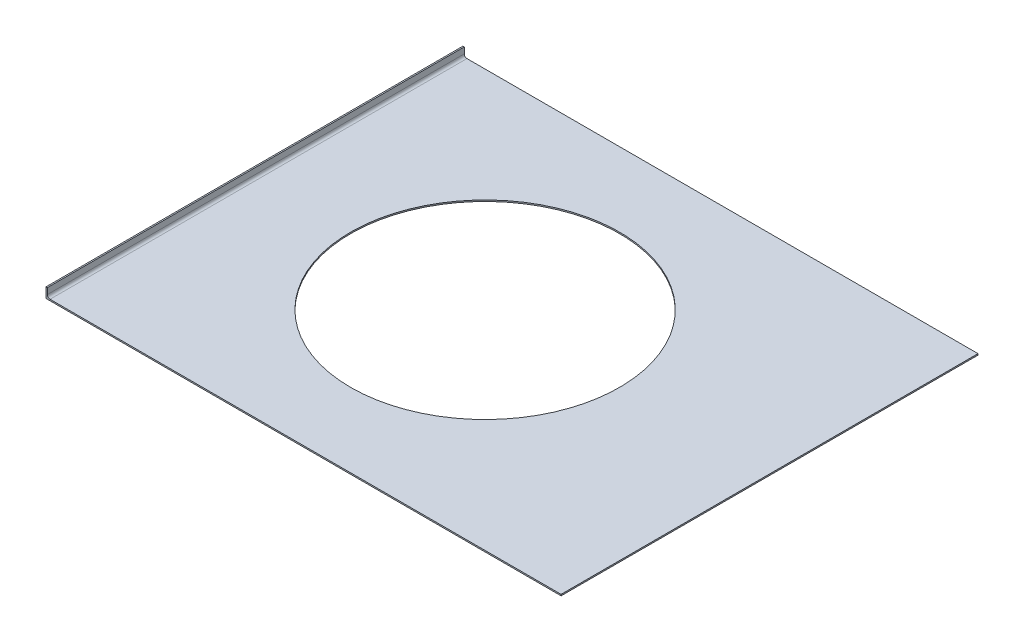
from build123d import *

# Parameters (mm, degrees)
SKETCH1_W                       = 486.41
SKETCH1_H                       = 393.7
BOSS_EXTRUDE1_DEPTH             = 0.635
SKETCH2_R                       = 127
CUT_EXTRUDE1_DEPTH              = 313.89008841
BOSS_EXTRUDE2_REACH             = 314.888
SKETCH6_W                       = 1.27
SKETCH6_H                       = 9.525
BOSS_EXTRUDE2_DIRECTION_2_REACH = 314.888
FILLET1_R                       = 2.54


with BuildPart() as part:
    # Sketch1 → Boss-Extrude1 (new, symmetric)
    with BuildSketch(Plane(origin=(0, 0, 0), x_dir=(1, 0, 0), z_dir=(0, 1, 0))):
        Rectangle(SKETCH1_W, SKETCH1_H)
    extrude(amount=BOSS_EXTRUDE1_DEPTH, both=True)

    # Sketch2 → Cut-Extrude1 (cut, through all)
    with BuildSketch(Plane(origin=(0, 0.635, 0), x_dir=(1, 0, 0), z_dir=(0, 1, 0))):
        with Locations(Location((-25.4, 0, 0), (0, 0, 270))):
            Circle(SKETCH2_R)
    extrude(amount=-CUT_EXTRUDE1_DEPTH, mode=Mode.SUBTRACT)

    # Boss-Extrude2: up to this face of the body (flat: up to its plane)
    boss_extrude2_end = Plane(part.part.faces().sort_by_distance((0, 0, 196.85))[0])
    # Sketch6 → Boss-Extrude2 (add, up to the picked face)
    with BuildSketch(Plane.XY, mode=Mode.PRIVATE) as boss_extrude2_sk1:
        with Locations((-242.57, 4.1275)):
            Rectangle(SKETCH6_W, SKETCH6_H)
    boss_extrude2_tool1 = split(extrude(boss_extrude2_sk1.sketch, amount=BOSS_EXTRUDE2_REACH, mode=Mode.PRIVATE), bisect_by=boss_extrude2_end, keep=Keep.BOTH, mode=Mode.PRIVATE)
    add(boss_extrude2_tool1.solids().sort_by(Axis((-242.57, 4.1275, 0), (0, 0, 1)))[0])

    # Boss-Extrude2 direction 2: up to this face of the body (flat: up to its plane)
    boss_extrude2_direction_2_end = Plane(part.part.faces().sort_by_distance((0, 0, -196.85))[0])
    # Sketch6 → Boss-Extrude2 direction 2 (add, up to the picked face)
    with BuildSketch(Plane.XY, mode=Mode.PRIVATE) as boss_extrude2_direction_2_sk1:
        with Locations((-242.57, 4.1275)):
            Rectangle(SKETCH6_W, SKETCH6_H)
    boss_extrude2_direction_2_tool1 = split(extrude(boss_extrude2_direction_2_sk1.sketch, amount=-BOSS_EXTRUDE2_DIRECTION_2_REACH, mode=Mode.PRIVATE), bisect_by=boss_extrude2_direction_2_end, keep=Keep.BOTH, mode=Mode.PRIVATE)
    add(boss_extrude2_direction_2_tool1.solids().sort_by(Axis((-242.57, 4.1275, 0), (0, 0, -1)))[0])

    # Fillet1
    fillet1_edges = [part.edges().sort_by_distance(p)[0] for p in [
        (-241.935, 0.635, 0),
    ]]
    fillet(fillet1_edges, radius=FILLET1_R)


solid = part.part
